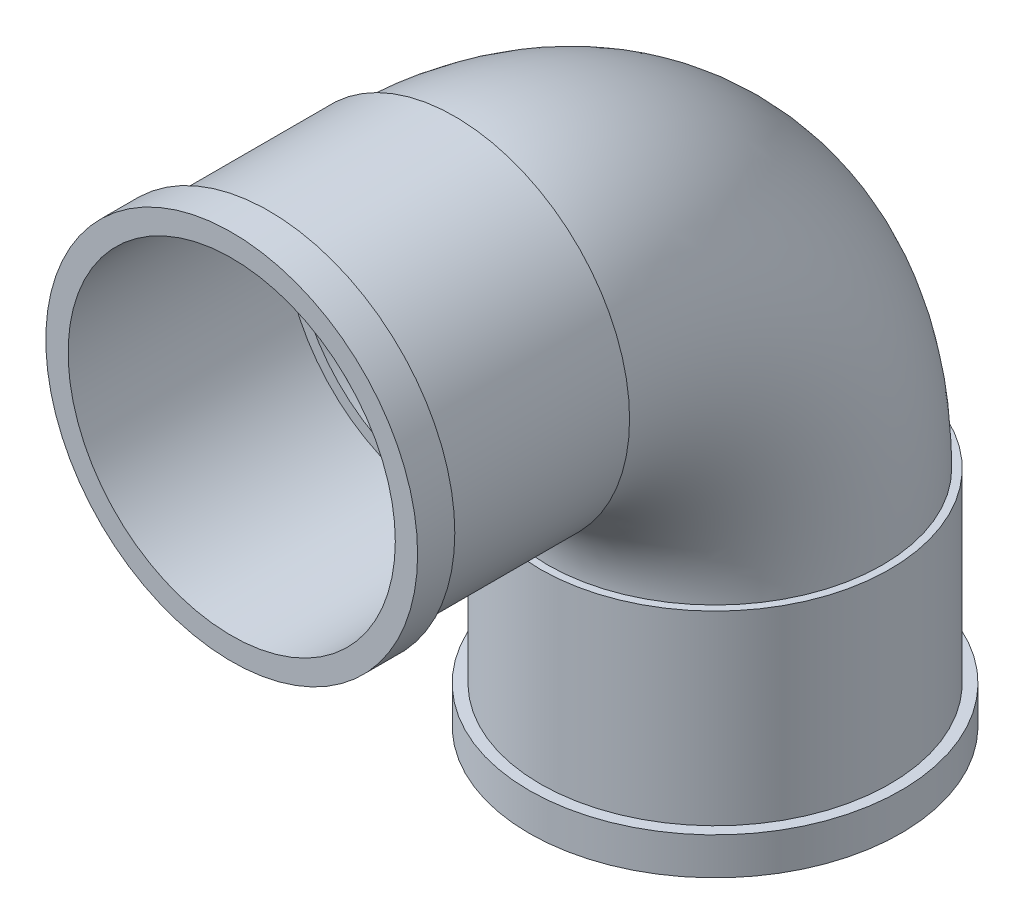
from build123d import *

# Parameters (mm, degrees)
SKELETON_R           = 23.5
SKELETON_R_2         = 22
SKELETON_R_3         = 20.5
BOSS_EXTRUDE1_DEPTH  = 30
SKELETON_3_R         = 22
SKELETON_3_R_2       = 20.5
CUT_EXTRUDE1_DEPTH   = 29
BOSS_EXTRUDE3_START  = -65
SKETCH6_R            = 23.5
SKETCH6_R_2          = 20.5
BOSS_EXTRUDE3_DEPTH  = 30
CUT_EXTRUDE2_START   = -65
SKETCH6_5_R          = 22
CUT_EXTRUDE2_DEPTH   = 29
SWEEP1_PROFILE_R     = 22.5
CUT_SWEEP1_PROFILE_R = 20.5
SKETCH36_W           = 5
SKETCH36_H           = 1.5
SKETCH36_3_W         = 1.5
SKETCH36_3_H         = 5


with BuildPart() as part:
    # Skeleton → Boss-Extrude1 (new body)
    # profile 1 of 2: a face of its own
    with BuildSketch(Plane.XY):
        Circle(SKELETON_R)
        Circle(SKELETON_R_2, mode=Mode.SUBTRACT)
    # profile 2 of 2: a face of its own
    with BuildSketch(Plane.XY):
        Circle(SKELETON_R_2)
        Circle(SKELETON_R_3, mode=Mode.SUBTRACT)
    extrude(amount=-BOSS_EXTRUDE1_DEPTH)

    # Skeleton<3> → Cut-Extrude1 (cut)
    with BuildSketch(Plane.XY):
        Circle(SKELETON_3_R)
        Circle(SKELETON_3_R_2, mode=Mode.SUBTRACT)
    extrude(amount=-CUT_EXTRUDE1_DEPTH, mode=Mode.SUBTRACT)



with BuildPart() as body_2:
    # Sketch6 → Boss-Extrude3 (new body)
    with BuildSketch(Plane(origin=(0, 0, 0), x_dir=(1, 0, 0), z_dir=(0, 1, 0)).offset(BOSS_EXTRUDE3_START)):
        with Locations(Location((0, 65, 0), (0, 0, 270))):
            Circle(SKETCH6_R)
        with Locations(Location((0, 65, 0), (0, 0, 270))):
            Circle(SKETCH6_R_2, mode=Mode.SUBTRACT)
    extrude(amount=BOSS_EXTRUDE3_DEPTH)

    # Sketch6<5> → Cut-Extrude2 (cut)
    with BuildSketch(Plane(origin=(0, 0, 0), x_dir=(1, 0, 0), z_dir=(0, 1, 0)).offset(CUT_EXTRUDE2_START)):
        with Locations(Location((0, 65, 0), (0, 0, 90))):
            Circle(SKETCH6_5_R)
    extrude(amount=CUT_EXTRUDE2_DEPTH, mode=Mode.SUBTRACT)


with BuildPart() as part_1:
    add(part.part)

    add(body_2.part)  # Sweep1 merges body 2
    # Sweep1: sweep along a path in Sketch4
    with BuildLine(Plane(origin=(0, 0, 0), x_dir=(0, 0, -1), z_dir=(1, 0, 0))) as sweep1_path:
        Line((29.074908745, 0), (30, 0))
        ThreePointArc((30, 0), (54.748737342, -10.251262658), (65, -35))
        Line((65, -35), (65, -36.362694274))
    # Sweep1 profile (on start of the path) → Sweep1 (sweep)
    with BuildSketch(Plane(origin=(0, 0, -29.074908745), x_dir=(-1, 0, 0), z_dir=(0, 0, -1))):
        Circle(SWEEP1_PROFILE_R)
    sweep(path=sweep1_path.line)

    # Cut-Sweep1: sweep along a path in Sketch4<2>
    with BuildLine(Plane(origin=(0, 0, 0), x_dir=(0, 0, -1), z_dir=(1, 0, 0))) as cut_sweep1_path:
        Line((29.074908745, 0), (30, 0))
        ThreePointArc((30, 0), (54.748737342, -10.251262658), (65, -35))
        Line((65, -35), (65, -36.362694274))
    # Cut-Sweep1 profile (on start of the path) → Cut-Sweep1 (sweep, cut)
    with BuildSketch(Plane(origin=(0, 0, -29.074908745), x_dir=(-1, 0, 0), z_dir=(0, 0, -1))):
        Circle(CUT_SWEEP1_PROFILE_R)
    sweep(path=cut_sweep1_path.line, mode=Mode.SUBTRACT)

    # Sketch36 → Revolve1 (revolve)
    with BuildSketch(Plane(origin=(0, 0, 0), x_dir=(0, 0, -1), z_dir=(1, 0, 0)), mode=Mode.PRIVATE) as revolve1_sk:
        with Locations((2.5, 24.25)):
            Rectangle(SKETCH36_W, SKETCH36_H)
    revolve(revolve1_sk.sketch.rotate(Axis((0, 0, 0), (0, 0, -1)), 90), axis=Axis((0, 0, 0), (0, 0, -1)))

    # Sketch36<3> → Revolve2 (revolve)
    with BuildSketch(Plane(origin=(0, 0, 0), x_dir=(0, 0, -1), z_dir=(1, 0, 0)), mode=Mode.PRIVATE) as revolve2_sk:
        with Locations((89.25, -62.5)):
            Rectangle(SKETCH36_3_W, SKETCH36_3_H)
    revolve(revolve2_sk.sketch.rotate(Axis((0, 0, -65), (0, -1, 0)), 180), axis=Axis((0, 0, -65), (0, -1, 0)))


solid = part_1.part
